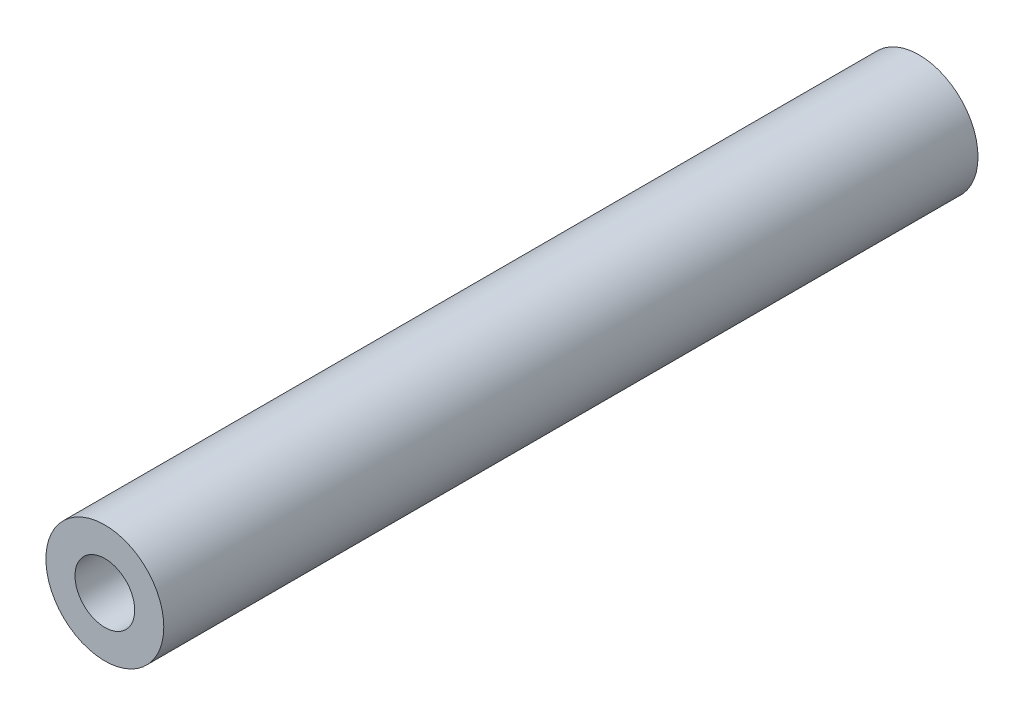
from build123d import *

# Parameters (mm, degrees)
SKETCH1_R           = 1.9558
SKETCH1_R_2         = 0.9906
BOSS_EXTRUDE1_DEPTH = 13.50645


with BuildPart() as part:
    # Sketch1 → Boss-Extrude1 (new, symmetric)
    with BuildSketch(Plane.XY):
        Circle(SKETCH1_R)
        Circle(SKETCH1_R_2, mode=Mode.SUBTRACT)
    extrude(amount=BOSS_EXTRUDE1_DEPTH, both=True)


solid = part.part
